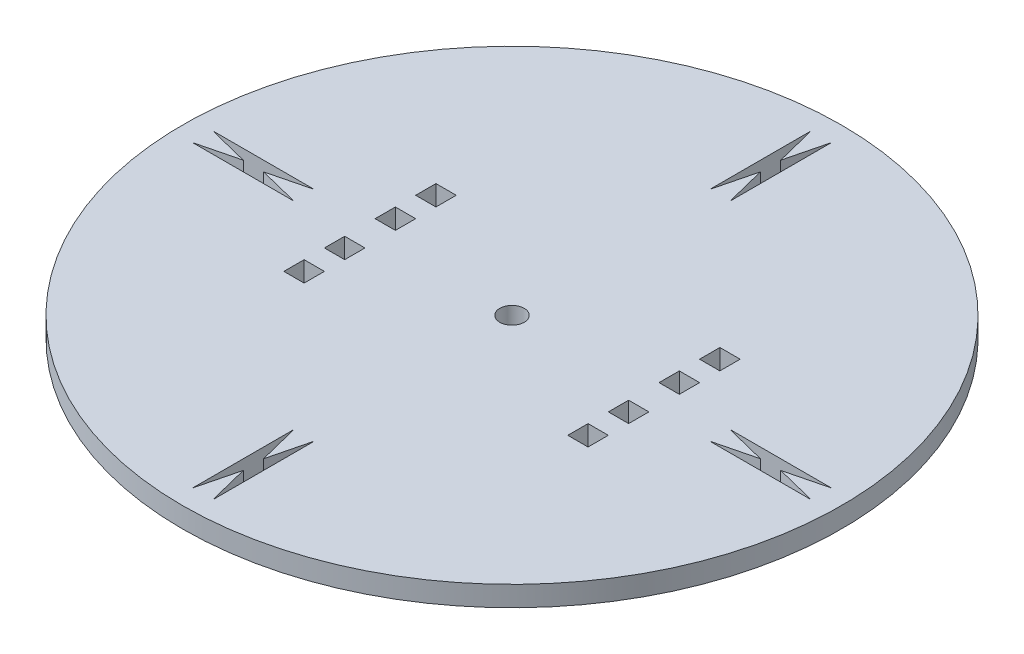
from build123d import *

# Parameters (mm, degrees)
SKETCH1_R           = 82.55
SKETCH1_R_2         = 3.048
BOSS_EXTRUDE1_DEPTH = 5.08
SKETCH2_W           = 5.08
SKETCH2_H           = 5.08
CUT_EXTRUDE1_DEPTH  = 5.08


with BuildPart() as part:
    # Sketch1 → Boss-Extrude1 (new body)
    with BuildSketch(Plane(origin=(0, 0, 0), x_dir=(1, 0, 0), z_dir=(0, 1, 0))):
        with Locations(Location((-36.198285131, 29.074154547, 0), (0, 0, 270))):
            Circle(SKETCH1_R)
        with Locations(Location((-36.198285131, 29.074154547, 0), (0, 0, 270))):
            Circle(SKETCH1_R_2, mode=Mode.SUBTRACT)
        Polygon((-36.198285131, 96.384154547), (-33.658285131, 106.544154547), (-33.658285131, 81.144154547), (-36.198285131, 91.304154547), (-38.738285131, 81.144154547), (-38.738285131, 106.544154547), align=None, mode=Mode.SUBTRACT)
        Polygon((31.111714869, 29.074154547), (41.271714869, 26.534154547), (15.871714869, 26.534154547), (26.031714869, 29.074154547), (15.871714869, 31.614154547), (41.271714869, 31.614154547), align=None, mode=Mode.SUBTRACT)
        Polygon((-36.198285131, -38.235845453), (-38.738285131, -48.395845453), (-38.738285131, -22.995845453), (-36.198285131, -33.155845453), (-33.658285131, -22.995845453), (-33.658285131, -48.395845453), align=None, mode=Mode.SUBTRACT)
        Polygon((-103.508285131, 29.074154547), (-113.668285131, 31.614154547), (-88.268285131, 31.614154547), (-98.428285131, 29.074154547), (-88.268285131, 26.534154547), (-113.668285131, 26.534154547), align=None, mode=Mode.SUBTRACT)
    extrude(amount=BOSS_EXTRUDE1_DEPTH)

    # Sketch2 → Cut-Extrude1 (cut)
    with BuildSketch(Plane(origin=(0, 5.08, 0), x_dir=(1, 0, 0), z_dir=(0, 1, 0))):
        with Locations((-0.638285131, 22.724154547)):
            Rectangle(SKETCH2_W, SKETCH2_H)
        with Locations((-0.638285131, 45.584154547)):
            Rectangle(SKETCH2_W, SKETCH2_H)
        with Locations((-0.638285131, 35.424154547)):
            Rectangle(SKETCH2_W, SKETCH2_H)
        with Locations((-0.638285131, 12.564154547)):
            Rectangle(SKETCH2_W, SKETCH2_H)
        with Locations((-71.758285131, 12.564154547)):
            Rectangle(SKETCH2_W, SKETCH2_H)
        with Locations((-71.758285131, 22.724154547)):
            Rectangle(SKETCH2_W, SKETCH2_H)
        with Locations((-71.758285131, 35.424154547)):
            Rectangle(SKETCH2_W, SKETCH2_H)
        with Locations((-71.758285131, 45.584154547)):
            Rectangle(SKETCH2_W, SKETCH2_H)
    extrude(amount=-CUT_EXTRUDE1_DEPTH, mode=Mode.SUBTRACT)


solid = part.part
